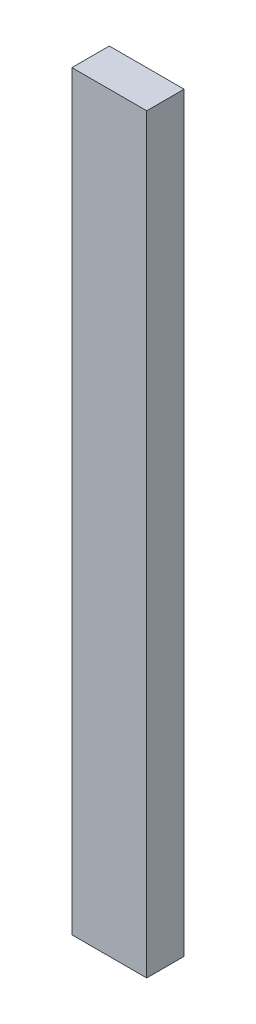
from build123d import *

# Parameters (mm, degrees)
ESQUISSE1_W        = 48
ESQUISSE1_H        = 482
BOSS_EXTRU_1_DEPTH = 24


with BuildPart() as part:
    # Esquisse1 → Boss.-Extru.1 (new body)
    with BuildSketch(Plane.XY):
        Rectangle(ESQUISSE1_W, ESQUISSE1_H)
    extrude(amount=BOSS_EXTRU_1_DEPTH)


solid = part.part
